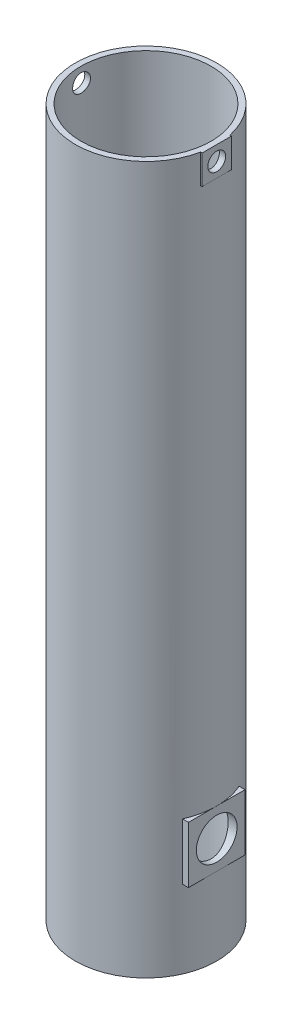
from build123d import *
from build123d.topology import SkipClean

# Parameters (mm, degrees)
SKETCH1_R                = 6.35
SKETCH1_R_2              = 5.842
BOSS_EXTRUDE1_DEPTH      = 63.5
SKETCH2_R                = 0.8001
CUT_EXTRUDE1_DEPTH       = 66.068137364
BOSS_EXTRUDE2_REACH      = 67.068
BOSS_EXTRUDE2_END_RADIUS = 6.35
SKETCH3_W                = 2.6162
SKETCH3_H                = 2.6162
SKETCH3_R                = 0.8001
SKETCH4_R                = 1.8288
CUT_EXTRUDE2_DEPTH       = 66.068137491
BOSS_EXTRUDE3_REACH      = 67.068
BOSS_EXTRUDE3_END_RADIUS = 6.35
SKETCH5_W                = 5.08
SKETCH5_H                = 5.08
SKETCH5_R                = 1.8288


with BuildPart() as part:
    # Sketch1 → Boss-Extrude1 (new body)
    with BuildSketch(Plane(origin=(0, 0, 0), x_dir=(1, 0, 0), z_dir=(0, 1, 0))):
        with Locations(Location((0, 0, 0), (0, 0, 270))):
            Circle(SKETCH1_R)
        with Locations(Location((0, 0, 0), (0, 0, 270))):
            Circle(SKETCH1_R_2, mode=Mode.SUBTRACT)
    extrude(amount=BOSS_EXTRUDE1_DEPTH)

    # Sketch2 → Cut-Extrude1 (cut, through all)
    with BuildSketch(Plane(origin=(6.35, 0, 0), x_dir=(0, 0, -1), z_dir=(1, 0, 0))):
        with Locations((0, 62.1919)):
            Circle(SKETCH2_R)
    extrude(amount=-CUT_EXTRUDE1_DEPTH, mode=Mode.SUBTRACT)

    # Boss-Extrude2: up to this cylinder (the profile starts outside it)
    with SkipClean():  # the faces are left unmerged after this step: merging them gives an invalid solid
        boss_extrude2_end = Plane(origin=(0, 60.920799, 0), z_dir=(0, -1, 0)) * Cylinder(BOSS_EXTRUDE2_END_RADIUS, 147.836, mode=Mode.PRIVATE)
        # Sketch3 → Boss-Extrude2 (add, up to the surface)
        with BuildSketch(Plane(origin=(6.35, 0, 0), x_dir=(0, 0, -1), z_dir=(1, 0, 0)), mode=Mode.PRIVATE) as boss_extrude2_sk1:
            with Locations((0, 62.1919)):
                Rectangle(SKETCH3_W, SKETCH3_H)
            with Locations((0, 62.1919)):
                Circle(SKETCH3_R, mode=Mode.SUBTRACT)
        boss_extrude2_tool1 = extrude(boss_extrude2_sk1.sketch, amount=-BOSS_EXTRUDE2_REACH, mode=Mode.PRIVATE) - boss_extrude2_end
        add(boss_extrude2_tool1.solids().sort_by_distance((6.35, 60.920799, 0))[0])
        add(boss_extrude2_tool1.solids().sort_by_distance((6.35, 60.920799, 0))[1])

    # Sketch4 → Cut-Extrude2 (cut, through all)
    with BuildSketch(Plane(origin=(6.35, 0, 0), x_dir=(0, 0, -1), z_dir=(1, 0, 0))):
        with Locations((0, 9.525)):
            Circle(SKETCH4_R)
    extrude(amount=-CUT_EXTRUDE2_DEPTH, mode=Mode.SUBTRACT)

    # Boss-Extrude3: up to this cylinder (the profile starts outside it)
    with SkipClean():  # the faces are left unmerged after this step: merging them gives an invalid solid
        boss_extrude3_end = Plane(origin=(0, 7.056842, 0), z_dir=(0, -1, 0)) * Cylinder(BOSS_EXTRUDE3_END_RADIUS, 147.836, mode=Mode.PRIVATE)
        # Sketch5 → Boss-Extrude3 (add, up to the surface)
        with BuildSketch(Plane(origin=(6.35, 0, 0), x_dir=(0, 0, -1), z_dir=(1, 0, 0)), mode=Mode.PRIVATE) as boss_extrude3_sk1:
            with Locations((0, 9.525)):
                Rectangle(SKETCH5_W, SKETCH5_H)
            with Locations((0, 9.525)):
                Circle(SKETCH5_R, mode=Mode.SUBTRACT)
        boss_extrude3_tool1 = extrude(boss_extrude3_sk1.sketch, amount=-BOSS_EXTRUDE3_REACH, mode=Mode.PRIVATE) - boss_extrude3_end
        add(boss_extrude3_tool1.solids().sort_by_distance((6.35, 7.056842, 0))[0])
        add(boss_extrude3_tool1.solids().sort_by_distance((6.35, 7.056842, 0))[1])


solid = part.part
